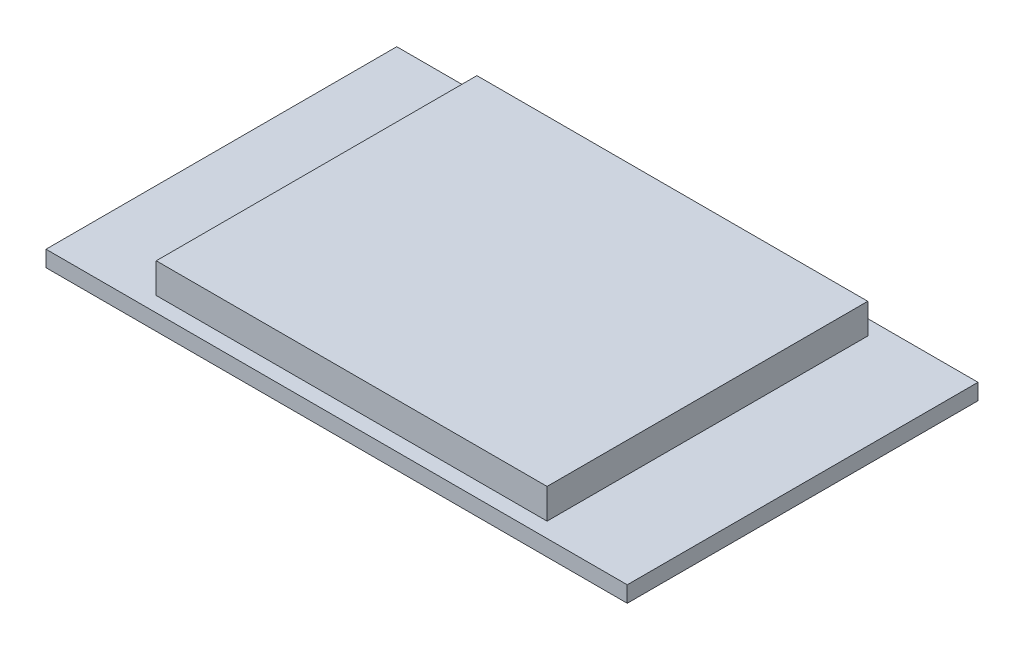
from build123d import *

# Parameters (mm, degrees)
LCD_GLASS_START = -3
SKETCH1_W       = 39
SKETCH1_H       = 32
LCD_GLASS_DEPTH = 3
BOARD_START     = -4.6
SKETCH2_W       = 58
SKETCH2_H       = 35
BOARD_DEPTH     = 1.6


with BuildPart() as part:
    # Sketch1 → LCD_Glass (new body)
    with BuildSketch(Plane(origin=(0, 0, 0), x_dir=(1, 0, 0), z_dir=(0, 1, 0)).offset(LCD_GLASS_START)):
        Rectangle(SKETCH1_W, SKETCH1_H)
    extrude(amount=LCD_GLASS_DEPTH)

    # Sketch2 → Board (add)
    with BuildSketch(Plane(origin=(0, 0, 0), x_dir=(1, 0, 0), z_dir=(0, 1, 0)).offset(BOARD_START)):
        Rectangle(SKETCH2_W, SKETCH2_H)
    extrude(amount=BOARD_DEPTH)


solid = part.part
